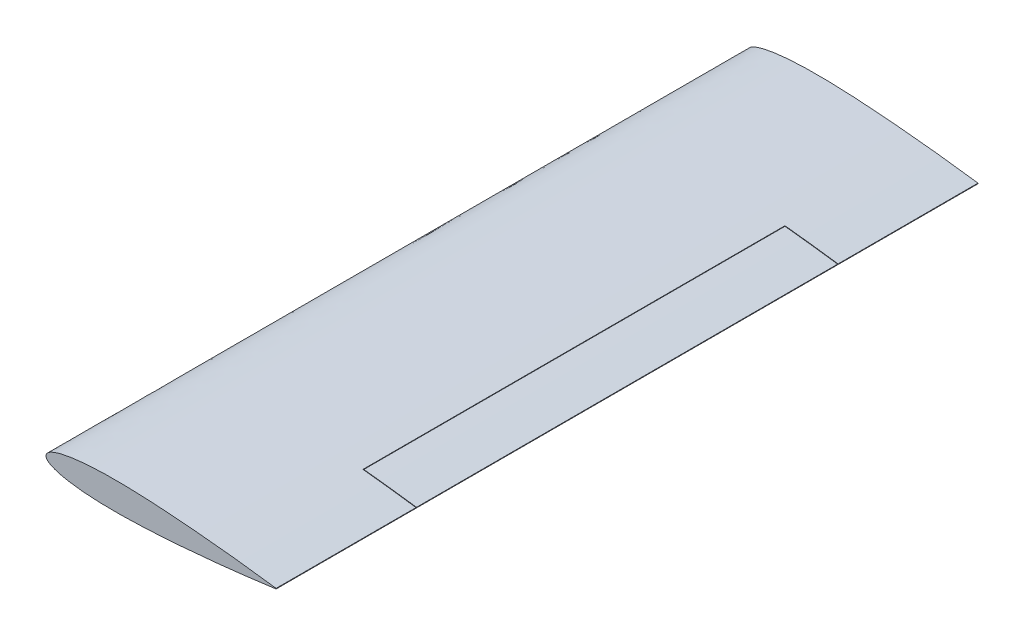
from build123d import *

# Parameters (mm, degrees)
BOSS_EXTRUDE1_DEPTH          = 387.35
CUT_EXTRUDE_THIN1_DEPTH      = 25.4
CUT_EXTRUDE_THIN1_DEPTH_BACK = 25.4
SKETCH8_W                    = 58.6105
SKETCH8_H                    = 232.918
SKETCH8_W_2                  = 58.1025
SKETCH8_H_2                  = 232.41


with BuildPart() as part:
    # Sketch1 → Boss-Extrude1 (new body)
    with BuildSketch(Plane.XY):
        with BuildLine():
            Line((0, 0), (0.0741553, -0.5410581))
            add(Edge.make_bspline(
                [(0.0741553, -0.5410581), (0.140193116, -0.721669288), (0.279359485, -1.102284586), (0.672953866, -1.621887631), (1.197372717, -2.127225876), (1.868546979, -2.614961799), (2.679805959, -3.087211333), (3.631807621, -3.542903378), (4.722270879, -3.981176782), (5.949220629, -4.400672498), (7.309979196, -4.800002189), (8.801569979, -5.177656111), (10.420601607, -5.532264877), (12.163391442, -5.862371272), (14.025910144, -6.166774384), (16.003859244, -6.444224904), (18.092638104, -6.693786188), (20.287392365, -6.914566798), (22.583004305, -7.105952415), (24.974124891, -7.267500336), (27.455183748, -7.398939329), (30.020387925, -7.50029876), (32.6637483, -7.571768113), (35.37909603, -7.613737924), (38.16009598, -7.6268579), (41.000252855, -7.611912582), (43.892935104, -7.569879311), (46.831388406, -7.501897019), (49.80875771, -7.409257979), (52.818088887, -7.293315259), (55.852352747, -7.155560507), (58.904465333, -6.997557268), (62.989718699, -6.76192592), (67.07428575, -6.492791876), (72.153153866, -6.122085821), (77.161565564, -5.723570073), (82.115167215, -5.291274037), (86.928545971, -4.846337775), (91.556695876, -4.396255017), (96.074209839, -3.930282916), (100.342395257, -3.472307631), (104.321343716, -3.029895637), (108.800275666, -2.509782412), (112.856241075, -2.01993467), (115.953937365, -1.632470119), (118.192651038, -1.345627894), (120.454508393, -1.051537975), (122.982051787, -0.715008334), (125.183869328, -0.413145258), (126.383583987, -0.246336664), (126.777898618, -0.191178133), (127, -0.16002)],
                knots=[0, 0, 0, 0, 0.004453098, 0.009384343, 0.014982663, 0.021372152, 0.028629372, 0.036799304, 0.0459059, 0.055958591, 0.066956833, 0.078892219, 0.091750574, 0.105513132, 0.120156922, 0.135655669, 0.151980062, 0.169098043, 0.186974925, 0.205573833, 0.224855766, 0.244779561, 0.265302077, 0.286378518, 0.307962448, 0.330005789, 0.352458937, 0.375271263, 0.398390839, 0.421764754, 0.445339233, 0.469059756, 0.492871393, 0.540546262, 0.56429809, 0.611352844, 0.65744173, 0.679988317, 0.72382058, 0.765630038, 0.785652286, 0.823696247, 0.858776431, 0.890561328, 0.918749863, 0.931410447, 0.943074149, 0.971818317, 0.990736353, 0.994781875, 1, 1, 1, 1], degree=3))
            Line((127, -0.16002), (127, 0.16002))
            add(Edge.make_bspline(
                [(0, 0), (0.014787865, 0.182587172), (0.045123671, 0.55714623), (0.289202643, 1.100069783), (0.669802119, 1.622596804), (1.198397925, 2.126995195), (1.868214507, 2.615036608), (2.679912557, 3.087187348), (3.631773923, 3.542910961), (4.72228138, 3.981174419), (5.9492174, 4.400673225), (7.309980177, 4.800001969), (8.801569684, 5.177656177), (10.420601695, 5.532264857), (12.163391416, 5.862371278), (14.025910152, 6.166774382), (16.003859242, 6.444224905), (18.092638105, 6.693786188), (20.287392365, 6.914566798), (22.583004305, 7.105952415), (24.974124891, 7.267500336), (27.455183748, 7.398939329), (30.020387925, 7.50029876), (32.6637483, 7.571768113), (35.37909603, 7.613737924), (38.16009598, 7.6268579), (41.000252855, 7.611912582), (43.892935104, 7.569879311), (46.831388406, 7.501897019), (49.80875771, 7.409257979), (52.818088887, 7.293315259), (55.852352747, 7.155560507), (58.904465333, 6.997557268), (62.989718699, 6.76192592), (67.07428575, 6.492791876), (72.153153866, 6.122085821), (77.161565564, 5.723570073), (82.115167215, 5.291274037), (86.928545971, 4.846337775), (91.556695876, 4.396255017), (96.074209839, 3.930282916), (100.342395257, 3.472307631), (104.321343716, 3.029895637), (108.800275666, 2.509782412), (112.856241075, 2.01993467), (115.953937365, 1.632470119), (118.192651038, 1.345627894), (120.454508393, 1.051537975), (122.982051787, 0.715008334), (125.183869328, 0.413145258), (126.383583987, 0.246336664), (126.777898618, 0.191178133), (127, 0.16002)],
                knots=[0, 0, 0, 0, 0.004217542, 0.008651859, 0.013562306, 0.019137014, 0.025499556, 0.032726168, 0.040861643, 0.049929832, 0.059940125, 0.070891981, 0.082777029, 0.095581153, 0.109285667, 0.123867697, 0.139301078, 0.155556621, 0.172602407, 0.190403892, 0.208924358, 0.228124969, 0.247964735, 0.268400696, 0.289388247, 0.310881146, 0.332831518, 0.355189968, 0.377906083, 0.40092815, 0.424203485, 0.447678538, 0.471299018, 0.495010229, 0.542484027, 0.566135681, 0.61299198, 0.658886484, 0.68133798, 0.724985379, 0.766618503, 0.786556306, 0.824439816, 0.859372048, 0.89102289, 0.919092539, 0.931699726, 0.943314236, 0.971937174, 0.990775422, 0.994803883, 1, 1, 1, 1], degree=3))
        make_face()
    extrude(amount=BOSS_EXTRUDE1_DEPTH)

    # Sketch8 → Cut-Extrude-Thin1 (cut, two sides: drawn at the far end of the back side and taken through both)
    with BuildSketch(Plane(origin=(0, 0, 0), x_dir=(1, 0, 0), z_dir=(0, 1, 0)).offset(-CUT_EXTRUDE_THIN1_DEPTH_BACK)):
        with Locations((127, -193.675)):
            Rectangle(SKETCH8_W, SKETCH8_H)
        with Locations((127, -193.675)):
            Rectangle(SKETCH8_W_2, SKETCH8_H_2, mode=Mode.SUBTRACT)
    extrude(amount=CUT_EXTRUDE_THIN1_DEPTH + CUT_EXTRUDE_THIN1_DEPTH_BACK, mode=Mode.SUBTRACT)


with BuildPart() as cut_extrude_thin1_piece_1:
    # of the separate pieces the step leaves, piece 1, a body of its own (cut_extrude_thin1_pieces)
    add(part.part.solids().sort_by_distance((0, 0, 0))[0])


with BuildPart() as cut_extrude_thin1_piece_2:
    # of the separate pieces the step leaves, piece 2, a body of its own (cut_extrude_thin1_pieces)
    add(part.part.solids().sort_by_distance((127, 0.16002, 77.47))[0])


solid = Compound([cut_extrude_thin1_piece_1.part, cut_extrude_thin1_piece_2.part])
